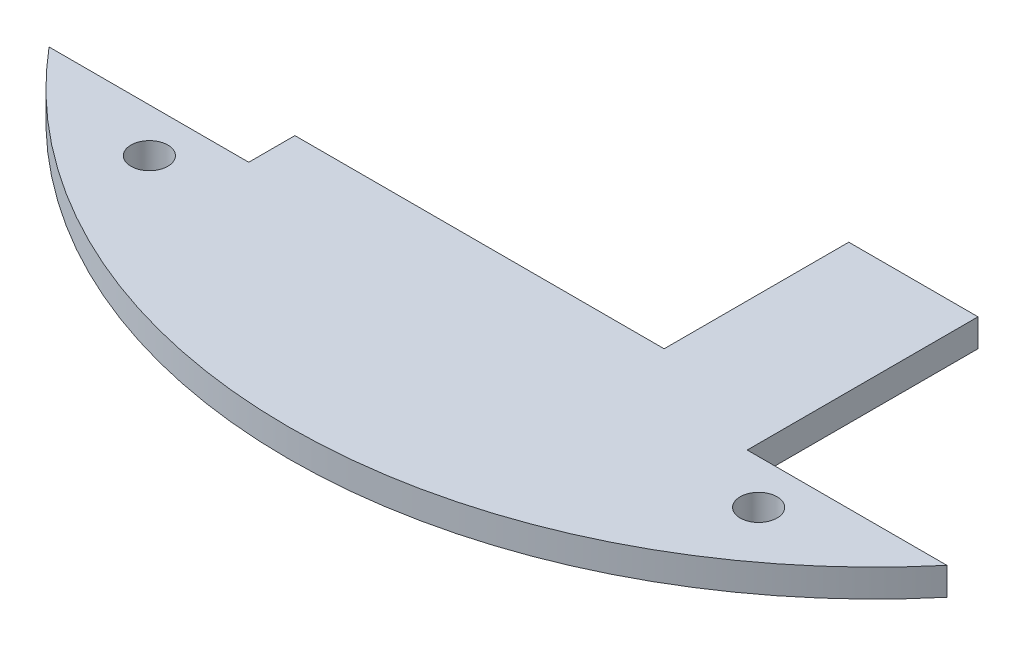
from build123d import *

# Parameters (mm, degrees)
SKETCH1_R           = 1
BOSS_EXTRUDE1_DEPTH = 1.5


with BuildPart() as part:
    # Sketch1 → Boss-Extrude1 (new body)
    with BuildSketch(Plane(origin=(0, 0, 0), x_dir=(1, 0, 0), z_dir=(0, 1, 0))):
        with BuildLine():
            Line((0, 0), (20, 0))
            Line((20, 0), (20, 10))
            Line((20, 10), (27, 10))
            Line((27, 10), (27, 0))
            Line((27, 0), (27, -2.5))
            Line((27, -2.5), (37.817581496, -2.5))
            ThreePointArc((37.817581496, -2.5), (32.861344207, -7.249817199), (27, -10.823288281))
            ThreePointArc((27, -10.823288281), (13.5, -13.83633472), (0, -10.823288281))
            ThreePointArc((0, -10.823288281), (-5.861344207, -7.249817199), (-10.817581496, -2.5))
            Line((-10.817581496, -2.5), (0, -2.5))
            Line((0, -2.5), (0, 0))
        make_face()
        with Locations(Location((30, -4.881961213, 0), (0, 0, 270))):
            Circle(SKETCH1_R, mode=Mode.SUBTRACT)
        with Locations(Location((-3, -4.881961213, 0), (0, 0, 90))):
            Circle(SKETCH1_R, mode=Mode.SUBTRACT)
    extrude(amount=BOSS_EXTRUDE1_DEPTH)


solid = part.part
